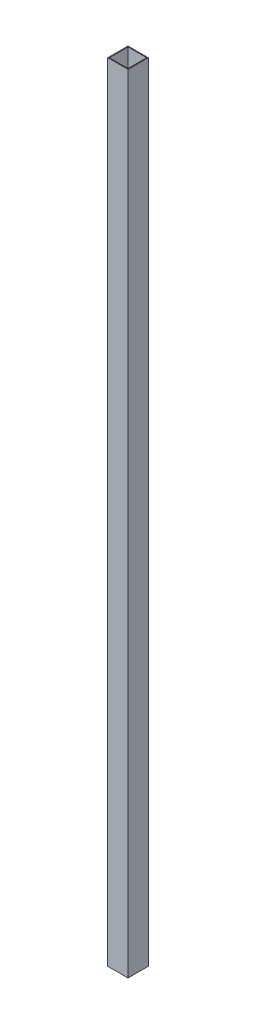
from build123d import *

# Parameters (mm, degrees)
SKETCH1_W           = 25
SKETCH1_H           = 25
SKETCH1_W_2         = 23
SKETCH1_H_2         = 23
BOSS_EXTRUDE1_DEPTH = 971


with BuildPart() as part:
    # Sketch1 → Boss-Extrude1 (new body)
    with BuildSketch(Plane(origin=(0, 0, 0), x_dir=(1, 0, 0), z_dir=(0, 1, 0))):
        Rectangle(SKETCH1_W, SKETCH1_H)
        Rectangle(SKETCH1_W_2, SKETCH1_H_2, mode=Mode.SUBTRACT)
    extrude(amount=BOSS_EXTRUDE1_DEPTH)


solid = part.part
